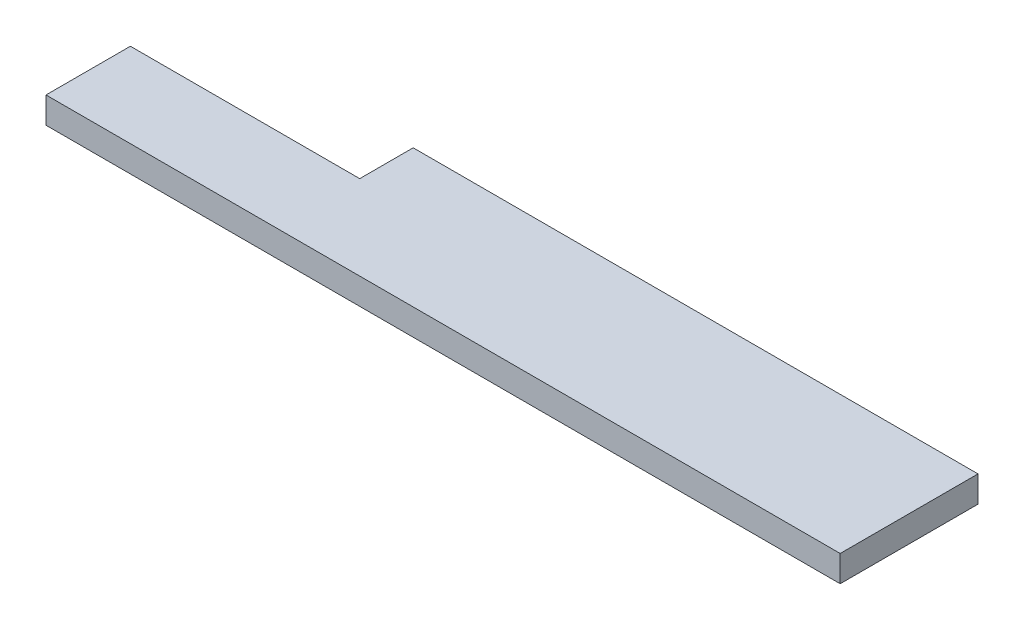
from build123d import *

# Parameters (mm, degrees)
SKETCH1_W               = 121
SKETCH1_H               = 21
BOSS_EXTRUDE1_DEPTH     = 4
CUT_EXTRUDE1_DEPTH      = 62.534543144
CUT_EXTRUDE1_DEPTH_BACK = 62.534543144
SKETCH2_W               = 36.59359186
SKETCH2_H               = 8.142757597


with BuildPart() as part:
    # Sketch1 → Boss-Extrude1 (new body)
    with BuildSketch(Plane(origin=(0, 0, 0), x_dir=(1, 0, 0), z_dir=(0, 1, 0))):
        Rectangle(SKETCH1_W, SKETCH1_H)
    extrude(amount=BOSS_EXTRUDE1_DEPTH)

    # Sketch2 → Cut-Extrude1 (cut, two sides: drawn at the far end of the back side and taken through both)
    with BuildSketch(Plane(origin=(0, 0, 0), x_dir=(1, 0, 0), z_dir=(0, 1, 0)).offset(-CUT_EXTRUDE1_DEPTH_BACK)):
        with Locations((-43.854273263, 6.428621202)):
            Rectangle(SKETCH2_W, SKETCH2_H)
    extrude(amount=CUT_EXTRUDE1_DEPTH + CUT_EXTRUDE1_DEPTH_BACK, mode=Mode.SUBTRACT)


solid = part.part
